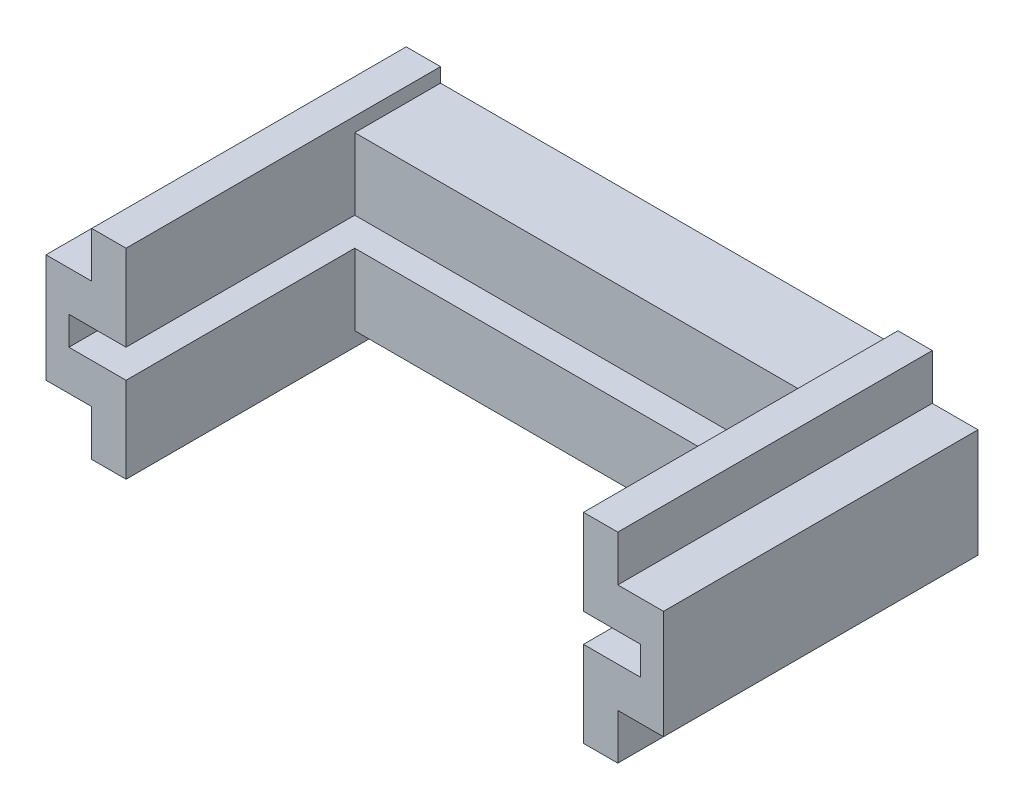
from build123d import *

# Parameters (mm, degrees)
BOSS_EXTRUDE1_DEPTH     = 9.525
BOSS_EXTRUDE2_DEPTH     = 25.4
SKETCH4_W               = 63.5
SKETCH4_H               = 3.175
CUT_EXTRUDE1_DEPTH      = 6.35
CUT_EXTRUDE2_DEPTH      = 45.095938092
CUT_EXTRUDE2_DEPTH_BACK = 45.095938092
SKETCH5_W               = 50.8
SKETCH5_H               = 1.5875


with BuildPart() as part:
    # Sketch1 → Boss-Extrude1 (new body)
    with BuildSketch(Plane.XY):
        Polygon((-29.21, -11.1125), (29.21, -11.1125), (29.21, -6.0325), (34.29, -6.0325), (34.29, 6.0325), (29.21, 6.0325), (29.21, 11.1125), (-29.21, 11.1125), (-29.21, 6.0325), (-34.29, 6.0325), (-34.29, -6.0325), (-29.21, -6.0325), align=None)
    extrude(amount=BOSS_EXTRUDE1_DEPTH)

    # Sketch3 → Boss-Extrude2 (add)
    with BuildSketch(Plane.XY.offset(9.525)):
        Polygon((-29.21, 11.1125), (-25.4, 11.1125), (-25.4, 1.5875), (-31.75, 1.5875), (-31.75, -1.5875), (-25.4, -1.5875), (-25.4, -11.1125), (-29.21, -11.1125), (-29.21, -6.0325), (-34.29, -6.0325), (-34.29, 6.0325), (-29.21, 6.0325), align=None)
        Polygon((25.4, -1.5875), (25.4, -11.1125), (29.21, -11.1125), (29.21, -6.0325), (34.29, -6.0325), (34.29, 6.0325), (29.21, 6.0325), (29.21, 11.1125), (25.4, 11.1125), (25.4, 1.5875), (31.75, 1.5875), (31.75, -1.5875), align=None)
    extrude(amount=BOSS_EXTRUDE2_DEPTH)

    # Sketch4 → Cut-Extrude1 (cut)
    with BuildSketch(Plane.XY.offset(9.525)):
        Rectangle(SKETCH4_W, SKETCH4_H)
    extrude(amount=-CUT_EXTRUDE1_DEPTH, mode=Mode.SUBTRACT)

    # Sketch5 → Cut-Extrude2 (cut, two sides: drawn at the far end of the back side and taken through both)
    with BuildSketch(Plane.XY.offset(9.525).offset(-CUT_EXTRUDE2_DEPTH_BACK)):
        with Locations((0, 10.31875)):
            Rectangle(SKETCH5_W, SKETCH5_H)
        with Locations((0, -10.31875)):
            Rectangle(SKETCH5_W, SKETCH5_H)
    extrude(amount=CUT_EXTRUDE2_DEPTH + CUT_EXTRUDE2_DEPTH_BACK, mode=Mode.SUBTRACT)


solid = part.part
